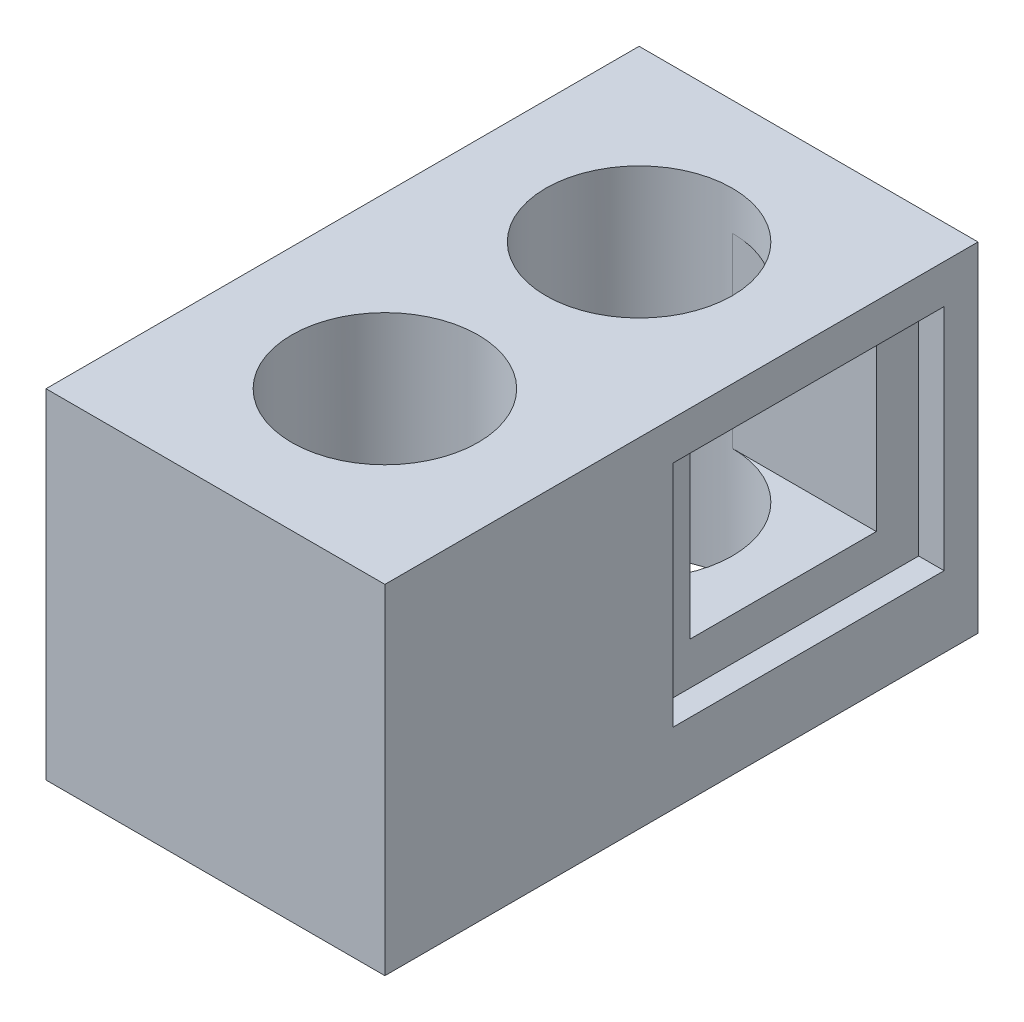
from build123d import *

# Parameters (mm, degrees)
CROQUIS1_W                 = 20
CROQUIS1_H                 = 35
CROQUIS1_R                 = 5
SALIENTE_EXTRUIR1_DEPTH    = 20
CROQUIS2_R                 = 2
SALIENTE_EXTRUIR2_DEPTH    = 8
CORTAR_EXTRUIR1_DEPTH      = 131.371097716
CORTAR_EXTRUIR1_DEPTH_BACK = 131.371097716
CROQUIS3_R                 = 5.5
CROQUIS4_W                 = 11
CROQUIS4_H                 = 11
CORTAR_EXTRUIR2_DEPTH      = 18
CROQUIS7_W                 = 16
CROQUIS7_H                 = 13.5
CORTAR_EXTRUIR3_DEPTH      = 1.5


with BuildPart() as part:
    # Croquis1 → Saliente-Extruir1 (new body)
    with BuildSketch(Plane(origin=(0, 0, 0), x_dir=(1, 0, 0), z_dir=(0, 1, 0))):
        with Locations((63.781004701, -82.04140038)):
            Rectangle(CROQUIS1_W, CROQUIS1_H)
        with Locations(Location((63.781004701, -89.54140038, 0), (0, 0, 270))):
            Circle(CROQUIS1_R, mode=Mode.SUBTRACT)
        with Locations(Location((63.781004701, -74.54140038, 0), (0, 0, 270))):
            Circle(CROQUIS1_R, mode=Mode.SUBTRACT)
    extrude(amount=SALIENTE_EXTRUIR1_DEPTH)

    # Croquis2 → Saliente-Extruir2 (add)
    with BuildSketch(Plane(origin=(73.781004701, 0, 0), x_dir=(0, 0, -1), z_dir=(1, 0, 0))):
        with Locations(Location((-74.54140038, 12.2, 0), (0, 0, 180))):
            Circle(CROQUIS2_R)
    extrude(amount=SALIENTE_EXTRUIR2_DEPTH)

    # Croquis3 → Cortar-Extruir1 (cut, two sides: drawn at the far end of the back side and taken through both)
    with BuildSketch(Plane(origin=(0, 20, 0), x_dir=(1, 0, 0), z_dir=(0, 1, 0)).offset(-CORTAR_EXTRUIR1_DEPTH_BACK)):
        with Locations(Location((63.781004701, -74.54140038, 0), (0, 0, 270))):
            Circle(CROQUIS3_R)
        with Locations(Location((63.781004701, -89.54140038, 0), (0, 0, 270))):
            Circle(CROQUIS3_R)
    extrude(amount=CORTAR_EXTRUIR1_DEPTH + CORTAR_EXTRUIR1_DEPTH_BACK, mode=Mode.SUBTRACT)

    # Croquis4 → Cortar-Extruir2 (cut)
    with BuildSketch(Plane(origin=(81.781004701, 0, 0), x_dir=(0, 0, -1), z_dir=(1, 0, 0))):
        with Locations((-74.54140038, 12.2)):
            Rectangle(CROQUIS4_W, CROQUIS4_H)
    extrude(amount=-CORTAR_EXTRUIR2_DEPTH, mode=Mode.SUBTRACT)

    # Croquis7 → Cortar-Extruir3 (cut)
    with BuildSketch(Plane(origin=(73.781004701, 0, 0), x_dir=(0, 0, -1), z_dir=(1, 0, 0))):
        with Locations((-74.54140038, 10.95)):
            Rectangle(CROQUIS7_W, CROQUIS7_H)
    extrude(amount=-CORTAR_EXTRUIR3_DEPTH, mode=Mode.SUBTRACT)


solid = part.part
